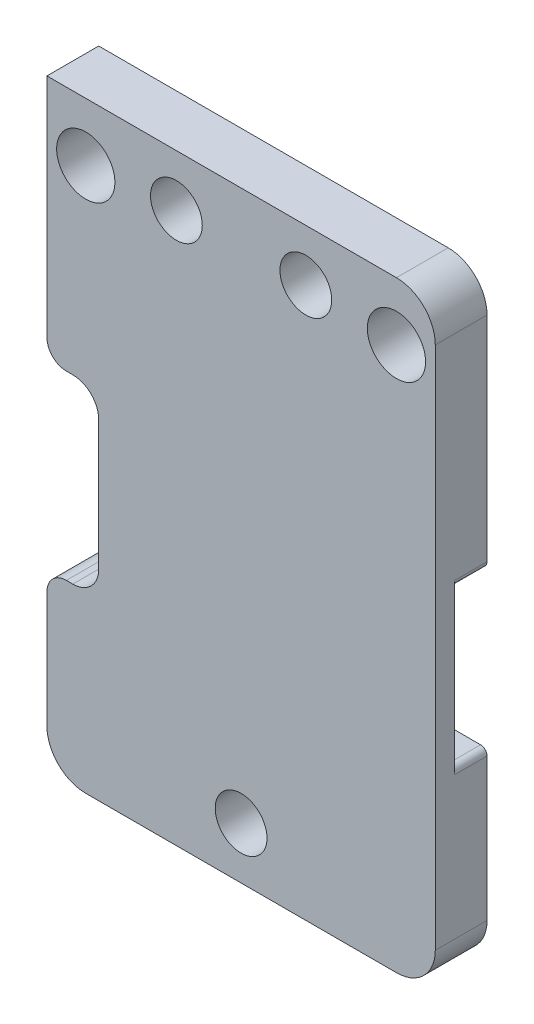
from build123d import *

# Parameters (mm, degrees)
SKETCH1_R           = 2
SKETCH1_R_2         = 2.25
BOSS_EXTRUDE1_DEPTH = 4
FILLET2_R           = 1.5
FILLET3_R           = 2
FILLET5_R           = 3
BOSS_EXTRUDE2_DEPTH = 1
CUT_EXTRUDE1_DEPTH  = 2.5
FILLET6_R           = 0.5


with BuildPart() as part:
    # Sketch1 → Boss-Extrude1 (new body)
    with BuildSketch(Plane.XY):
        Polygon((0, 27.5), (0, 46.5), (30, 46.5), (30, 25), (30, 16), (30, 0), (0, 0), (0, 13.5), (4, 13.5), (4, 15), (4, 26), (4, 27.5), align=None)
        with Locations((20, 42.5)):
            Circle(SKETCH1_R, mode=Mode.SUBTRACT)
        with Locations((15, 4)):
            Circle(SKETCH1_R, mode=Mode.SUBTRACT)
        with Locations((10, 42.5)):
            Circle(SKETCH1_R, mode=Mode.SUBTRACT)
        with Locations((3, 42)):
            Circle(SKETCH1_R_2, mode=Mode.SUBTRACT)
        with Locations((27, 42)):
            Circle(SKETCH1_R_2, mode=Mode.SUBTRACT)
    extrude(amount=BOSS_EXTRUDE1_DEPTH)

    # Fillet2
    fillet2_edges = [part.edges().sort_by_distance(p)[0] for p in [
        (0, 27.5, 2),
        (0, 13.5, 2),
    ]]
    fillet(fillet2_edges, radius=FILLET2_R)

    # Fillet3
    fillet3_edges = [part.edges().sort_by_distance(p)[0] for p in [
        (4, 27.5, 2),
        (4, 13.5, 2),
    ]]
    fillet(fillet3_edges, radius=FILLET3_R)

    # Fillet5
    fillet5_edges = [part.edges().sort_by_distance(p)[0] for p in [
        (30, 46.5, 2),
        (30, 0, 2),
        (0, 0, 2),
    ]]
    fillet(fillet5_edges, radius=FILLET5_R)

    # Sketch2 → Boss-Extrude2 (add)
    with BuildSketch(Plane(origin=(0, 0, 0), x_dir=(-1, 0, 0), z_dir=(0, 0, -1))):
        with BuildLine():
            Line((-26, 34.5), (-18.464101615, 34.5))
            ThreePointArc((-18.464101615, 34.5), (-17.464101615, 34.767949192), (-16.732050808, 35.5))
            ThreePointArc((-16.732050808, 35.5), (-15, 36.5), (-13.267949192, 35.5))
            ThreePointArc((-13.267949192, 35.5), (-12.535898385, 34.767949192), (-11.535898385, 34.5))
            Line((-11.535898385, 34.5), (-4, 34.5))
            ThreePointArc((-4, 34.5), (-2, 32.5), (-4, 30.5))
            Line((-4, 30.5), (-26, 30.5))
            ThreePointArc((-26, 30.5), (-28, 32.5), (-26, 34.5))
        make_face()
        with BuildLine():
            Line((-26, 10.5), (-4, 10.5))
            ThreePointArc((-4, 10.5), (-2, 8.5), (-4, 6.5))
            Line((-4, 6.5), (-5.535898385, 6.5))
            ThreePointArc((-5.535898385, 6.5), (-6.535898385, 6.232050808), (-7.267949192, 5.5))
            ThreePointArc((-7.267949192, 5.5), (-9, 4.5), (-10.732050808, 5.5))
            ThreePointArc((-10.732050808, 5.5), (-11.464101615, 6.232050808), (-12.464101615, 6.5))
            Line((-12.464101615, 6.5), (-17.535898385, 6.5))
            ThreePointArc((-17.535898385, 6.5), (-18.535898385, 6.232050808), (-19.267949192, 5.5))
            ThreePointArc((-19.267949192, 5.5), (-21, 4.5), (-22.732050808, 5.5))
            ThreePointArc((-22.732050808, 5.5), (-23.464101615, 6.232050808), (-24.464101615, 6.5))
            Line((-24.464101615, 6.5), (-26, 6.5))
            ThreePointArc((-26, 6.5), (-28, 8.5), (-26, 10.5))
        make_face()
    extrude(amount=BOSS_EXTRUDE2_DEPTH)

    # Sketch3 → Cut-Extrude1 (cut)
    with BuildSketch(Plane(origin=(0, 0, 0), x_dir=(-1, 0, 0), z_dir=(0, 0, -1))):
        Polygon((2.333212821, 27), (-12.5, 27), (-13.618033989, 26.5), (-30, 26.5), (-30, 14.5), (-13.5, 14.5), (-12.499999912, 14), (2.333212821, 14), align=None)
    extrude(amount=-CUT_EXTRUDE1_DEPTH, mode=Mode.SUBTRACT)

    # Fillet6
    fillet6_edges = [part.edges().sort_by_distance(p)[0] for p in [
        (3.322875656, 27, 1.25),
        (3.322875656, 14, 1.25),
        (30, 14.5, 1.25),
        (30, 26.5, 1.25),
    ]]
    fillet(fillet6_edges, radius=FILLET6_R)


solid = part.part
